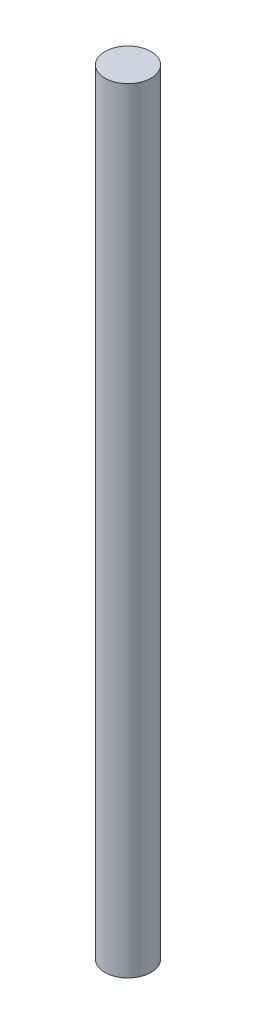
from build123d import *

# Parameters (mm, degrees)
SKETCH1_R           = 8.89
BOSS_EXTRUDE1_DEPTH = 298.45


with BuildPart() as part:
    # Sketch1 → Boss-Extrude1 (new body)
    with BuildSketch(Plane(origin=(0, 0, 0), x_dir=(1, 0, 0), z_dir=(0, 1, 0))):
        with Locations(Location((0, 0, 0), (0, 0, 270))):
            Circle(SKETCH1_R)
    extrude(amount=BOSS_EXTRUDE1_DEPTH)


solid = part.part
